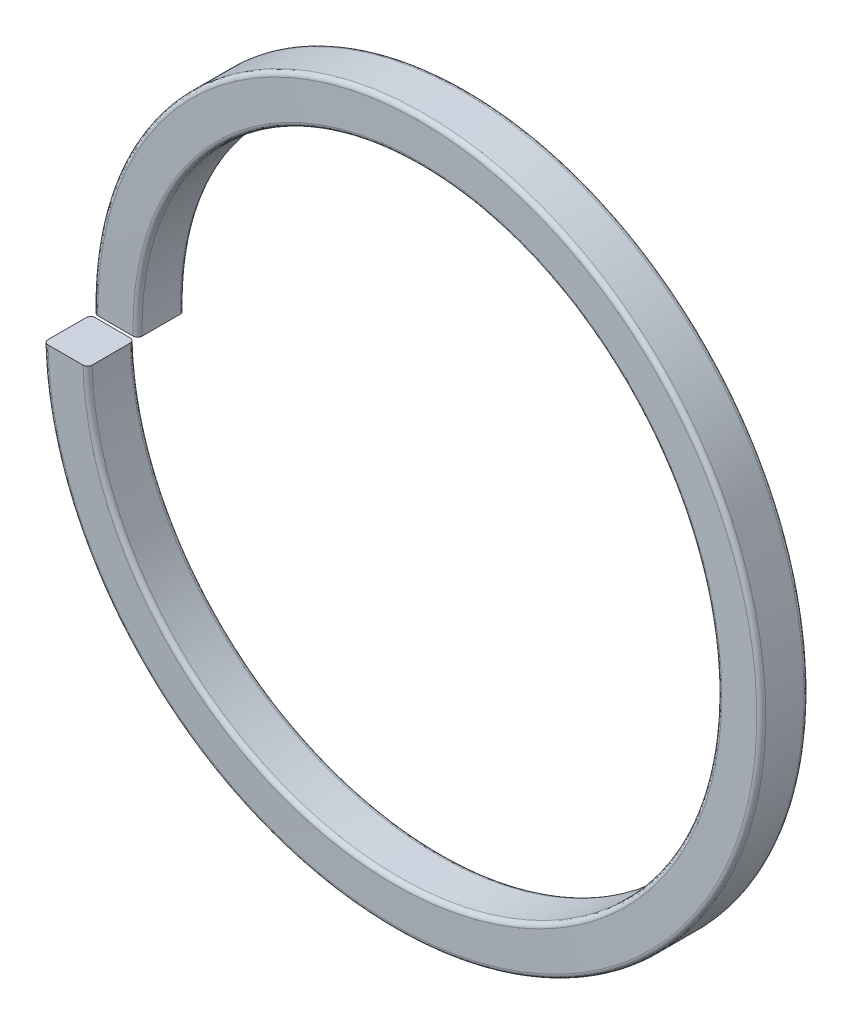
from build123d import *

# Parameters (mm, degrees)
SWEEP4_PITCH       = 1
SWEEP4_HEIGHT      = 1
SWEEP4_RADIUS      = 6.5
SWEEP4_START_ANGLE = -180


with BuildPart() as part:
    # Sweep4: sweep along a helix
    with BuildLine() as sweep4_path:
        add(Helix(SWEEP4_PITCH, SWEEP4_HEIGHT, SWEEP4_RADIUS, center=(0, 0, 0), direction=(0, 0, 1), lefthand=True, mode=Mode.PRIVATE).rotate(Axis((0, 0, 0), (0, 0, 1)), SWEEP4_START_ANGLE))
    # Sketch3 → Sweep4 (sweep)
    with BuildSketch(Plane(origin=(0, 0, 0), x_dir=(1, 0, 0), z_dir=(0, 1, 0))):
        with BuildLine():
            Line((-6.8262917, -0.510433316), (-6.125570321, -0.510433316))
            ThreePointArc((-6.125570321, -0.510433316), (-6.06193071, -0.536793706), (-6.035570321, -0.600433316))
            Line((-6.035570321, -0.600433316), (-6.035570321, -1.362929656))
            ThreePointArc((-6.035570321, -1.362929656), (-6.06193071, -1.426569266), (-6.125570321, -1.452929656))
            Line((-6.125570321, -1.452929656), (-6.8262917, -1.452929656))
            ThreePointArc((-6.8262917, -1.452929656), (-6.889931311, -1.426569266), (-6.9162917, -1.362929656))
            Line((-6.9162917, -1.362929656), (-6.9162917, -0.600433316))
            ThreePointArc((-6.9162917, -0.600433316), (-6.889931311, -0.536793706), (-6.8262917, -0.510433316))
        make_face()
    sweep(path=sweep4_path.line, is_frenet=True)


solid = part.part
